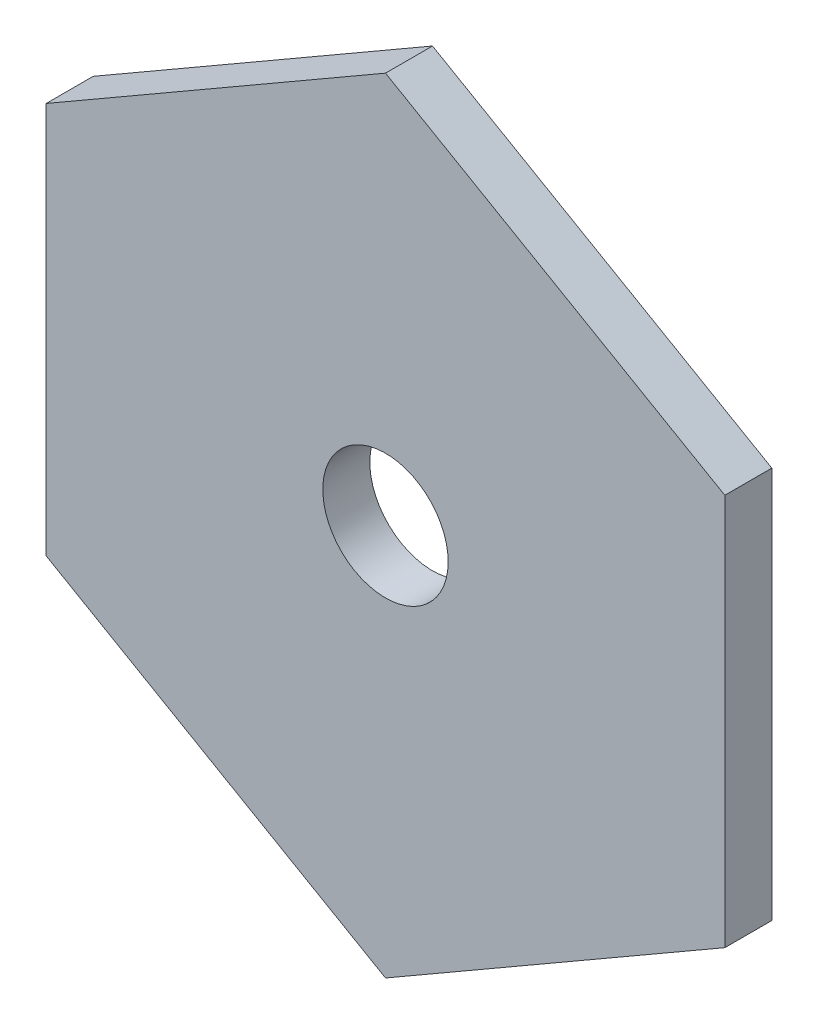
from build123d import *

# Parameters (mm, degrees)
BOSS_EXTRUDE1_DEPTH = 3
SKETCH2_R           = 4
CUT_EXTRUDE1_DEPTH  = 3


with BuildPart() as part:
    # Sketch1 → Boss-Extrude1 (new body)
    with BuildSketch(Plane.XY):
        Polygon((0, 25), (-21.650635095, 12.5), (-21.650635095, -12.5), (0, -25), (21.650635095, -12.5), (21.650635095, 12.5), align=None)
    extrude(amount=BOSS_EXTRUDE1_DEPTH)

    # Sketch2 → Cut-Extrude1 (cut)
    with BuildSketch(Plane.XY.offset(3)):
        Circle(SKETCH2_R)
    extrude(amount=-CUT_EXTRUDE1_DEPTH, mode=Mode.SUBTRACT)


solid = part.part
